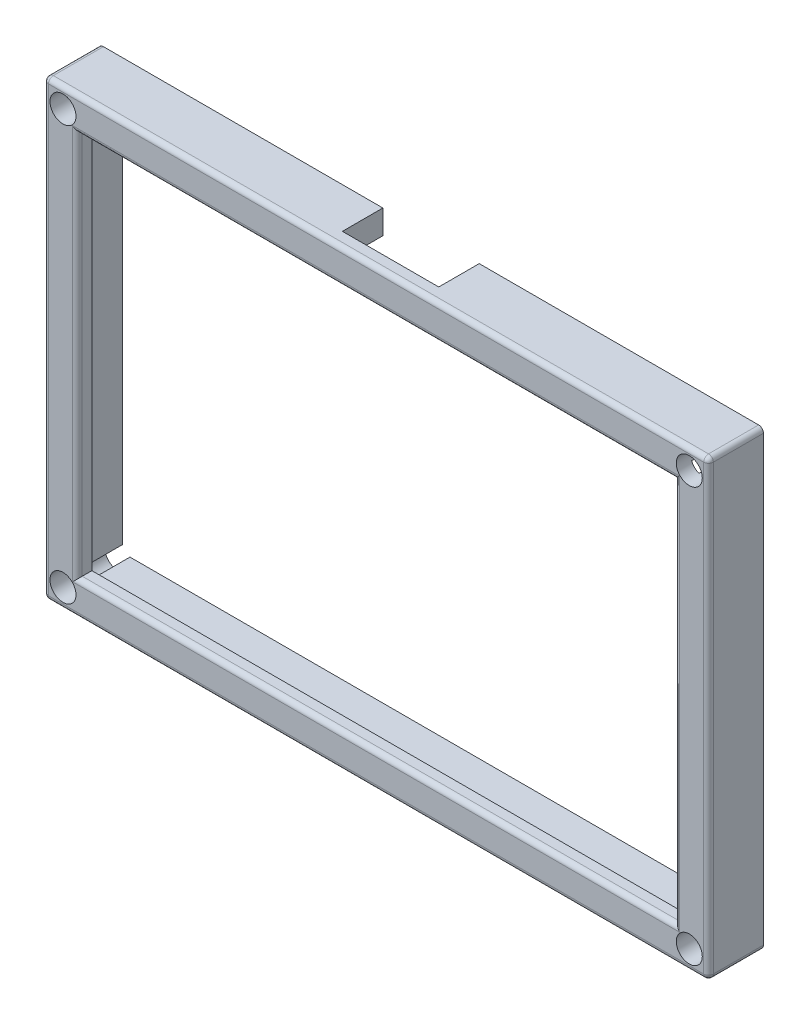
from build123d import *

# Parameters (mm, degrees)
BOSS_EXTRUDE1_DEPTH = 4.2
SKETCH2_W           = 62
SKETCH2_H           = 40
BOSS_EXTRUDE2_DEPTH = 1.5
FILLET1_R           = 0.5


with BuildPart() as part:
    # Sketch1 → Boss-Extrude1 (new body)
    with BuildSketch(Plane.XY):
        with BuildLine():
            Line((-5, 73.5), (-34.5, 73.5))
            Line((-34.5, 73.5), (-34.5, 26.5))
            Line((-34.5, 26.5), (34.5, 26.5))
            Line((34.5, 26.5), (34.5, 73.5))
            Line((34.5, 73.5), (5, 73.5))
            Line((5, 73.5), (5, 71))
            Line((5, 71), (31.24600638, 71))
            ThreePointArc((31.24600638, 71), (32.245433101, 72.825781164), (33.85, 71.5))
            ThreePointArc((33.85, 71.5), (33.25746287, 70.382525168), (32, 70.24600638))
            Line((32, 70.24600638), (32, 29.75399362))
            ThreePointArc((32, 29.75399362), (33.25746287, 29.617474832), (33.85, 28.5))
            ThreePointArc((33.85, 28.5), (32.245433101, 27.174218836), (31.24600638, 29))
            Line((31.24600638, 29), (-31.24600638, 29))
            ThreePointArc((-31.24600638, 29), (-31.174218836, 28.754566899), (-31.15, 28.5))
            ThreePointArc((-31.15, 28.5), (-33.617474832, 27.74253713), (-32, 29.75399362))
            Line((-32, 29.75399362), (-32, 70.24600638))
            ThreePointArc((-32, 70.24600638), (-33.617474832, 72.25746287), (-31.15, 71.5))
            ThreePointArc((-31.15, 71.5), (-31.174218836, 71.245433101), (-31.24600638, 71))
            Line((-31.24600638, 71), (-5, 71))
            Line((-5, 71), (-5, 73.5))
        make_face()
    extrude(amount=BOSS_EXTRUDE1_DEPTH)

    # Sketch2 → Boss-Extrude2 (add)
    # profile 1 of 2: a face of its own
    with BuildSketch(Plane.XY.offset(4.2)):
        with BuildLine():
            Line((31.24600638, 29), (-31.24600638, 29))
            ThreePointArc((-31.24600638, 29), (-33.454594155, 27.545405845), (-32, 29.75399362))
            Line((-32, 29.75399362), (-32, 70.24600638))
            ThreePointArc((-32, 70.24600638), (-33.454594155, 72.454594155), (-31.24600638, 71))
            Line((-31.24600638, 71), (-5, 71))
            Line((-5, 71), (-5, 73.5))
            Line((-5, 73.5), (-34.5, 73.5))
            Line((-34.5, 73.5), (-34.5, 26.5))
            Line((-34.5, 26.5), (34.5, 26.5))
            Line((34.5, 26.5), (34.5, 73.5))
            Line((34.5, 73.5), (5, 73.5))
            Line((5, 73.5), (5, 71))
            Line((5, 71), (31.24600638, 71))
            ThreePointArc((31.24600638, 71), (33.454594155, 72.454594155), (32, 70.24600638))
            Line((32, 70.24600638), (32, 29.75399362))
            ThreePointArc((32, 29.75399362), (33.454594155, 27.545405845), (31.24600638, 29))
        make_face()
    # profile 2 of 2: a face of its own
    with BuildSketch(Plane.XY.offset(4.2)):
        with BuildLine():
            Line((5, 71), (5, 73.5))
            Line((5, 73.5), (-5, 73.5))
            Line((-5, 73.5), (-5, 71))
            Line((-5, 71), (-31.24600638, 71))
            ThreePointArc((-31.24600638, 71), (-31.545405845, 70.545405845), (-32, 70.24600638))
            Line((-32, 70.24600638), (-32, 29.75399362))
            ThreePointArc((-32, 29.75399362), (-31.545405845, 29.454594155), (-31.24600638, 29))
            Line((-31.24600638, 29), (31.24600638, 29))
            ThreePointArc((31.24600638, 29), (31.545405845, 29.454594155), (32, 29.75399362))
            Line((32, 29.75399362), (32, 70.24600638))
            ThreePointArc((32, 70.24600638), (31.545405845, 70.545405845), (31.24600638, 71))
            Line((31.24600638, 71), (5, 71))
        make_face()
        with Locations((0, 50)):
            Rectangle(SKETCH2_W, SKETCH2_H, mode=Mode.SUBTRACT)
    extrude(amount=BOSS_EXTRUDE2_DEPTH)

    # Fillet1
    fillet1_edges = [part.edges().sort_by_distance(p)[0] for p in [
        (34.5, 73.5, 2.85),
        (34.5, 26.5, 2.85),
        (-34.5, 26.5, 2.85),
        (-34.5, 73.5, 2.85),
        (-31, 50, 5.7),
        (0, 30, 5.7),
        (34.5, 50, 5.7),
        (0, 73.5, 5.7),
        (-34.5, 50, 5.7),
        (0, 26.5, 5.7),
        (0, 70, 5.7),
        (31, 50, 5.7),
    ]]
    fillet(fillet1_edges, radius=FILLET1_R)


solid = part.part
